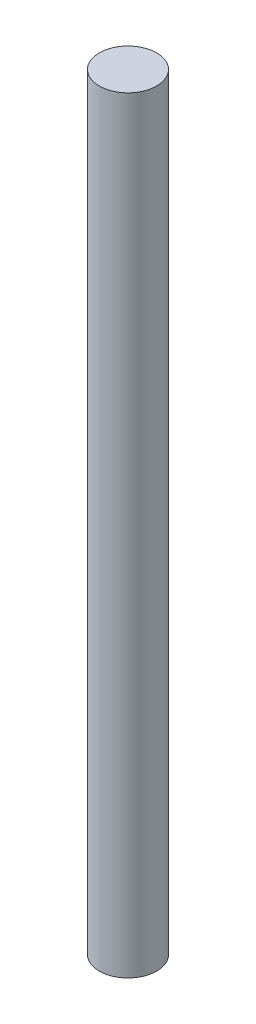
from build123d import *

# Parameters (mm, degrees)
SKETCH1_R           = 1.385
BOSS_EXTRUDE1_DEPTH = 37


with BuildPart() as part:
    # Sketch1 → Boss-Extrude1 (new body)
    with BuildSketch(Plane(origin=(0, 0, 0), x_dir=(1, 0, 0), z_dir=(0, 1, 0))):
        with Locations(Location((0, 0, 0), (0, 0, 270))):
            Circle(SKETCH1_R)
    extrude(amount=BOSS_EXTRUDE1_DEPTH)


solid = part.part
